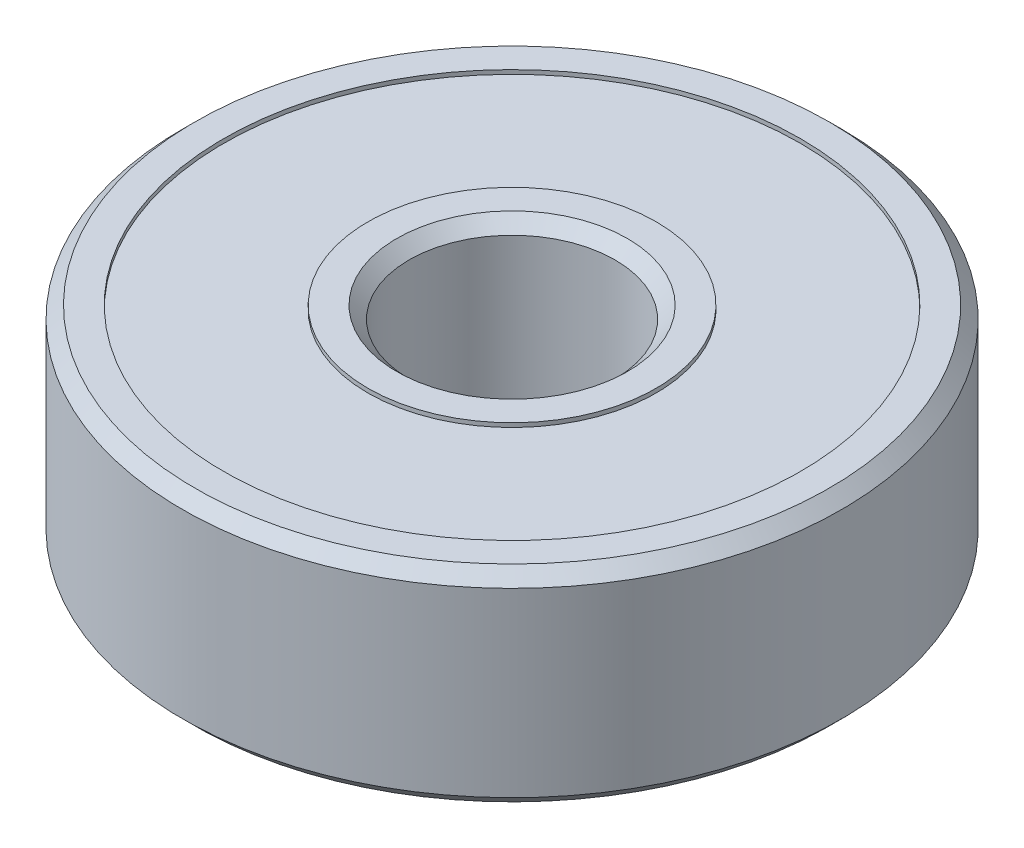
from build123d import *


with BuildPart() as part:
    # Esquisse1 → Révolution2 (revolve)
    with BuildSketch(Plane.XY, mode=Mode.PRIVATE) as r_volution2_sk:
        Polygon((2.5, -2.2), (2.5, 2.2), (2.8, 2.5), (3.5, 2.5), (3.5, 2.4), (7, 2.4), (7, 2.5), (7.7, 2.5), (8, 2.2), (8, -2.2), (7.7, -2.5), (7, -2.5), (7, -2.4), (3.5, -2.4), (3.5, -2.5), (2.8, -2.5), align=None)
    revolve(r_volution2_sk.sketch.rotate(Axis((0, 0, 0), (0, 1, 0)), 90), axis=Axis((0, 0, 0), (0, 1, 0)))


solid = part.part
